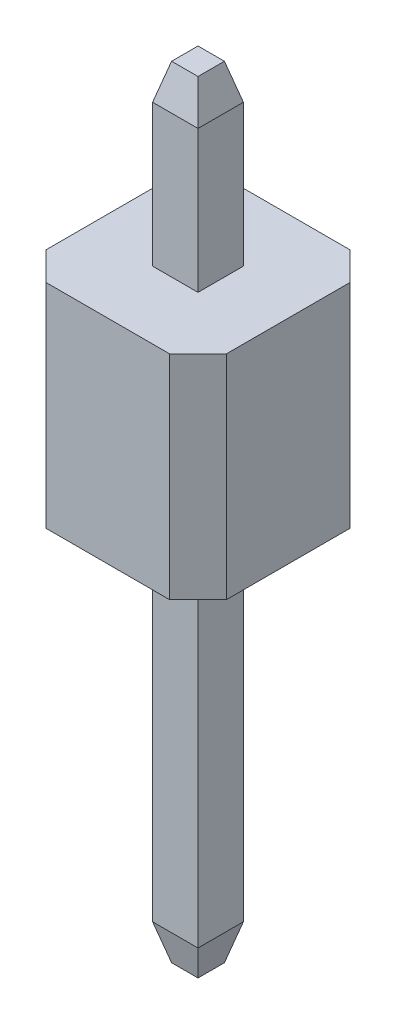
from build123d import *

# Parameters (mm, degrees)
SKETCH1_W                = 2.54
SKETCH1_H                = 2.54
BOSS_EXTRUDE1_DEPTH      = 3
CHAMFER1_SIZE            = 0.4
BOSS_EXTRUDE2_DEPTH      = 5
BOSS_EXTRUDE2_DEPTH_BACK = 5
SKETCH2_W                = 0.64
SKETCH2_H                = 0.64
SKETCH3_W                = 0.64
SKETCH3_H                = 0.64
BOSS_EXTRUDE3_DEPTH      = 0.5
BOSS_EXTRUDE3_TAPER      = 15


with BuildPart() as part:
    # Sketch1 → Boss-Extrude1 (new body)
    with BuildSketch(Plane(origin=(0, 0, 0), x_dir=(1, 0, 0), z_dir=(0, 1, 0))):
        Rectangle(SKETCH1_W, SKETCH1_H)
    extrude(amount=BOSS_EXTRUDE1_DEPTH)

    # Chamfer1
    chamfer1_edges = [part.edges().sort_by_distance(p)[0] for p in [
        (1.27, 1.5, 1.27),
        (-1.27, 1.5, 1.27),
        (-1.27, 1.5, -1.27),
        (1.27, 1.5, -1.27),
    ]]
    chamfer(chamfer1_edges, length=CHAMFER1_SIZE)

    # Sketch2 → Boss-Extrude2 (add, two sides: drawn at the far end of the back side and taken through both)
    with BuildSketch(Plane.XZ.offset(-BOSS_EXTRUDE2_DEPTH_BACK)):
        Rectangle(SKETCH2_W, SKETCH2_H)
    extrude(amount=BOSS_EXTRUDE2_DEPTH + BOSS_EXTRUDE2_DEPTH_BACK)

    # Sketch3 → Boss-Extrude3 (add)
    with BuildSketch(Plane(origin=(0, 5, 0), x_dir=(1, 0, 0), z_dir=(0, 1, 0))):
        Rectangle(SKETCH3_W, SKETCH3_H)
    boss_extrude3 = extrude(amount=BOSS_EXTRUDE3_DEPTH, taper=BOSS_EXTRUDE3_TAPER)

    # Mirror1: Boss-Extrude3 across plane
    add(boss_extrude3.mirror(Plane.ZX))


solid = part.part
